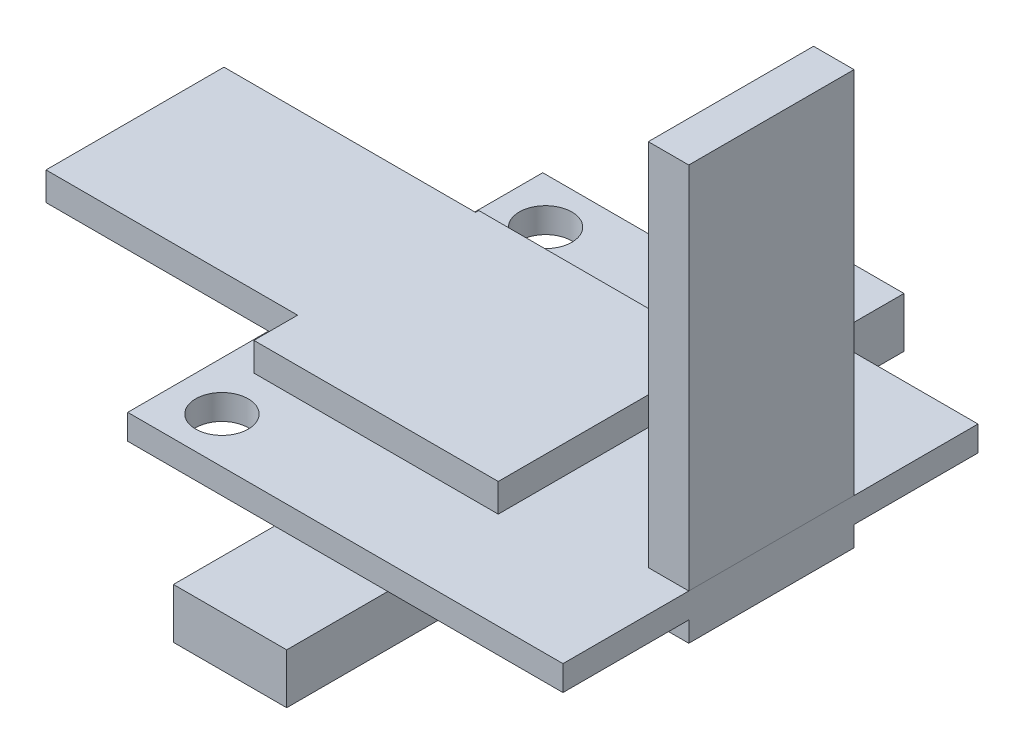
from build123d import *

# Parameters (mm, degrees)
SKETCH1_W             = 27.3304
SKETCH1_H             = 26.0604
SKETCH1_R             = 1.651
BOSS_EXTRUDE1_DEPTH   = 1.5748
BOSS_EXTRUDE2_DEPTH   = 1.778
SKETCH3_W             = 2.54
SKETCH3_H             = 10.3759
BOSS_EXTRUDE3_DEPTH   = 23.1648
SKETCH4_W             = 7.112
SKETCH4_H             = 11.43
BOSS_EXTRUDE4_DEPTH   = 3.1496
BOSS_EXTRUDE4_2_DEPTH = 3.1496
SKETCH5_W             = 2.54
SKETCH5_H             = 10.3759
BOSS_EXTRUDE5_DEPTH   = 1.27
SKETCH6_W             = 10.0584
SKETCH6_H             = 8.128
BOSS_EXTRUDE6_DEPTH   = 1.143


with BuildPart() as part:
    # Sketch1 → Boss-Extrude1 (new body)
    with BuildSketch(Plane(origin=(0, 0, 0), x_dir=(1, 0, 0), z_dir=(0, 1, 0))):
        Rectangle(SKETCH1_W, SKETCH1_H)
        with Locations(Location((-10.6172, 10.16, 0), (0, 0, 270))):
            Circle(SKETCH1_R, mode=Mode.SUBTRACT)
        with Locations(Location((-10.6172, -10.16, 0), (0, 0, 270))):
            Circle(SKETCH1_R, mode=Mode.SUBTRACT)
    extrude(amount=BOSS_EXTRUDE1_DEPTH)

    # Sketch5 → Boss-Extrude5 (add)
    with BuildSketch(Plane.XZ):
        with Locations((12.3952, -0.05715)):
            Rectangle(SKETCH5_W, SKETCH5_H)
    extrude(amount=BOSS_EXTRUDE5_DEPTH)


with BuildPart() as body_2:
    # Sketch2 → Boss-Extrude2 (new body)
    with BuildSketch(Plane(origin=(0, 1.5748, 0), x_dir=(1, 0, 0), z_dir=(0, 1, 0))):
        Polygon((-11.8364, 6.985), (-27.6352, 6.985), (-27.6352, -4.191), (-11.8364, -4.191), (-11.8364, -6.9342), (3.5052, -6.9342), (3.5052, 7.1882), (-11.8364, 7.1882), align=None)
    extrude(amount=BOSS_EXTRUDE2_DEPTH)


with BuildPart() as body_3:
    # Sketch3 → Boss-Extrude3 (new body)
    with BuildSketch(Plane(origin=(0, 1.5748, 0), x_dir=(1, 0, 0), z_dir=(0, 1, 0))):
        with Locations((12.3952, 0.05715)):
            Rectangle(SKETCH3_W, SKETCH3_H)
    extrude(amount=BOSS_EXTRUDE3_DEPTH)


with BuildPart() as body_4:
    # Sketch4 → Boss-Extrude4 (new body)
    with BuildSketch(Plane.XZ):
        with Locations((-0.889, 13.6652)):
            Rectangle(SKETCH4_W, SKETCH4_H)
    extrude(amount=BOSS_EXTRUDE4_DEPTH)


with BuildPart() as body_5:
    # Sketch4 → Boss-Extrude4 2 (new body)
    with BuildSketch(Plane.XZ):
        with Locations((-0.889, -13.6652)):
            Rectangle(SKETCH4_W, SKETCH4_H)
    extrude(amount=BOSS_EXTRUDE4_2_DEPTH)


with BuildPart() as body_6:
    # Sketch6 → Boss-Extrude6 (new body)
    with BuildSketch(Plane.XZ):
        Rectangle(SKETCH6_W, SKETCH6_H)
    extrude(amount=BOSS_EXTRUDE6_DEPTH)


solid = Compound([part.part, body_2.part, body_3.part, body_4.part, body_5.part, body_6.part])
